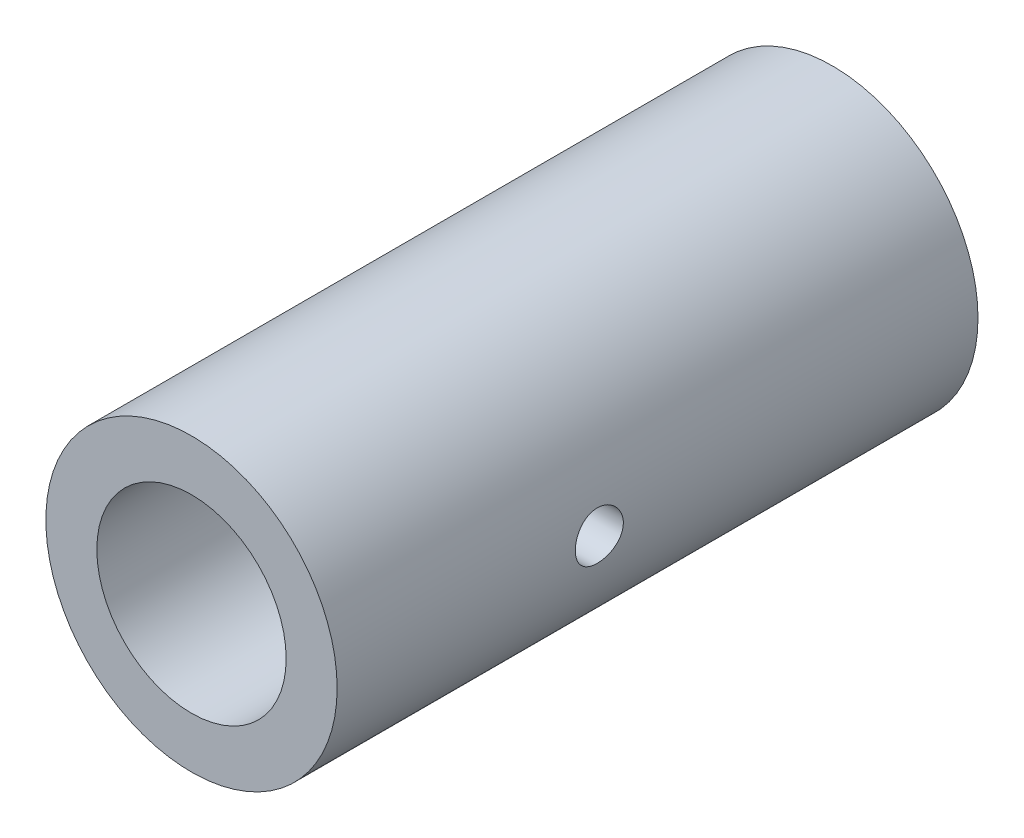
from build123d import *

# Parameters (mm, degrees)
SKETCH_1_R          = 10
EXTRUDE_1_DEPTH     = 44
SKETCH_2_R          = 6.5
CUT_EXTRUDE_1_DEPTH = 27
M4X0_71_D           = 3.3
M3X0_51_D           = 2.5
M3X0_51_DEPTH       = 8.5
M3X0_51_TIP         = 0.751075774


with BuildPart() as part:
    # Эскиз1 → Бобышка-Вытянуть1 (new body)
    with BuildSketch(Plane.XY):
        Circle(SKETCH_1_R)
    extrude(amount=EXTRUDE_1_DEPTH)

    # Эскиз2 → Вырез-Вытянуть1 (cut)
    with BuildSketch(Plane.XY.offset(44)):
        Circle(SKETCH_2_R)
    extrude(amount=-CUT_EXTRUDE_1_DEPTH, mode=Mode.SUBTRACT)

    # Отверстие обработанное метчиком M4x0.71 (through all)
    with Locations(Plane(origin=(-10, 0, 0), x_dir=(0, 0, -1), z_dir=(-1, 0, 0))):
        with Locations((-26, 0)):
            Hole(M4X0_71_D / 2)

    # Отверстие обработанное метчиком M3x0.51
    with Locations(Plane(origin=(0, 0, 0), x_dir=(-1, 0, 0), z_dir=(0, 0, -1))):
        with Locations((-4.242640687, 4.242640687), (4.242640687, 4.242640687), (4.242640687, -4.242640687), (-4.242640687, -4.242640687)):
            Hole(M3X0_51_D / 2, depth=M3X0_51_DEPTH)
            with Locations((0, 0, -(M3X0_51_DEPTH + M3X0_51_TIP / 2))):  # 118° drill point
                Cone(0, M3X0_51_D / 2, M3X0_51_TIP, mode=Mode.SUBTRACT)


solid = part.part
